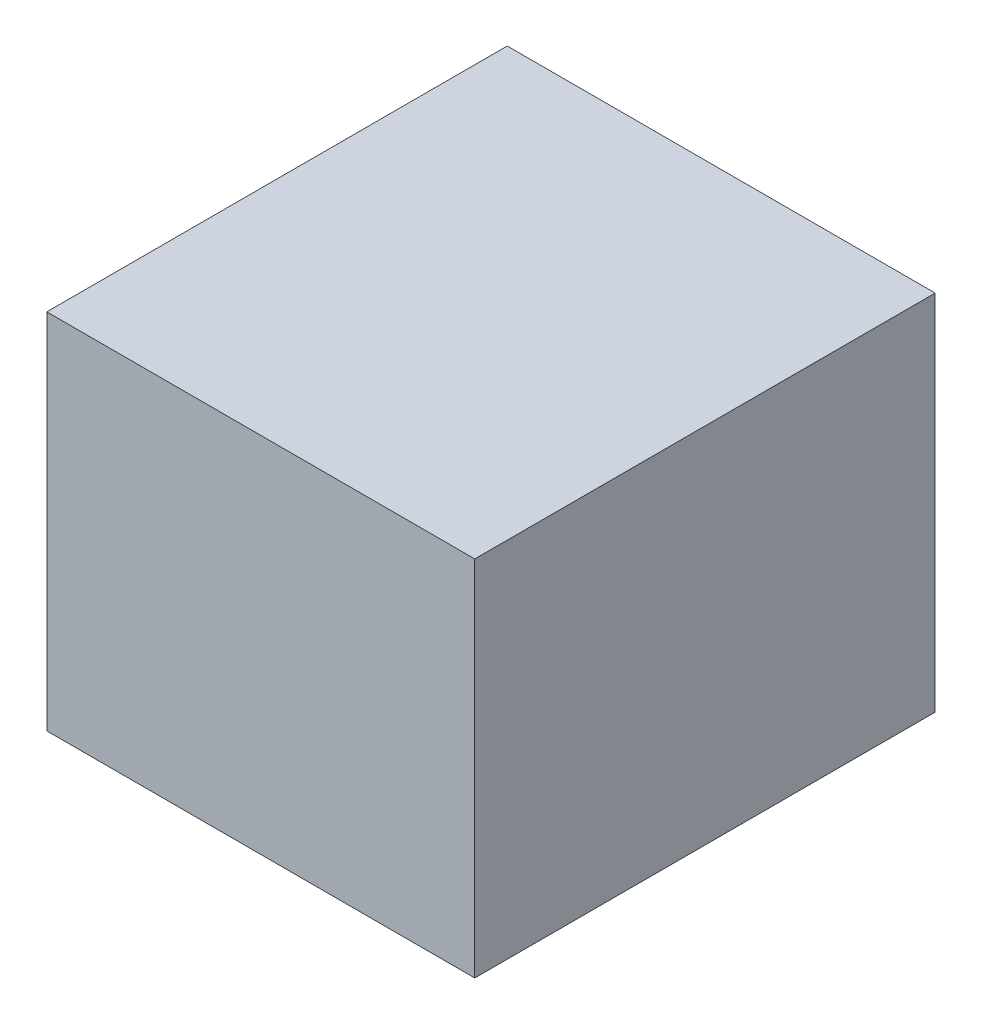
from build123d import *

# Parameters (mm, degrees)
IZIM1_W                     = 79
IZIM1_H                     = 67
Y_KSEKLIK_EKSTR_ZYON1_DEPTH = 85


with BuildPart() as part:
    # Çizim1 → Yükseklik-Ekstrüzyon1 (new body)
    with BuildSketch(Plane.XY):
        with Locations((-31.724455693, 8.243067591)):
            Rectangle(IZIM1_W, IZIM1_H)
    extrude(amount=Y_KSEKLIK_EKSTR_ZYON1_DEPTH)


solid = part.part
